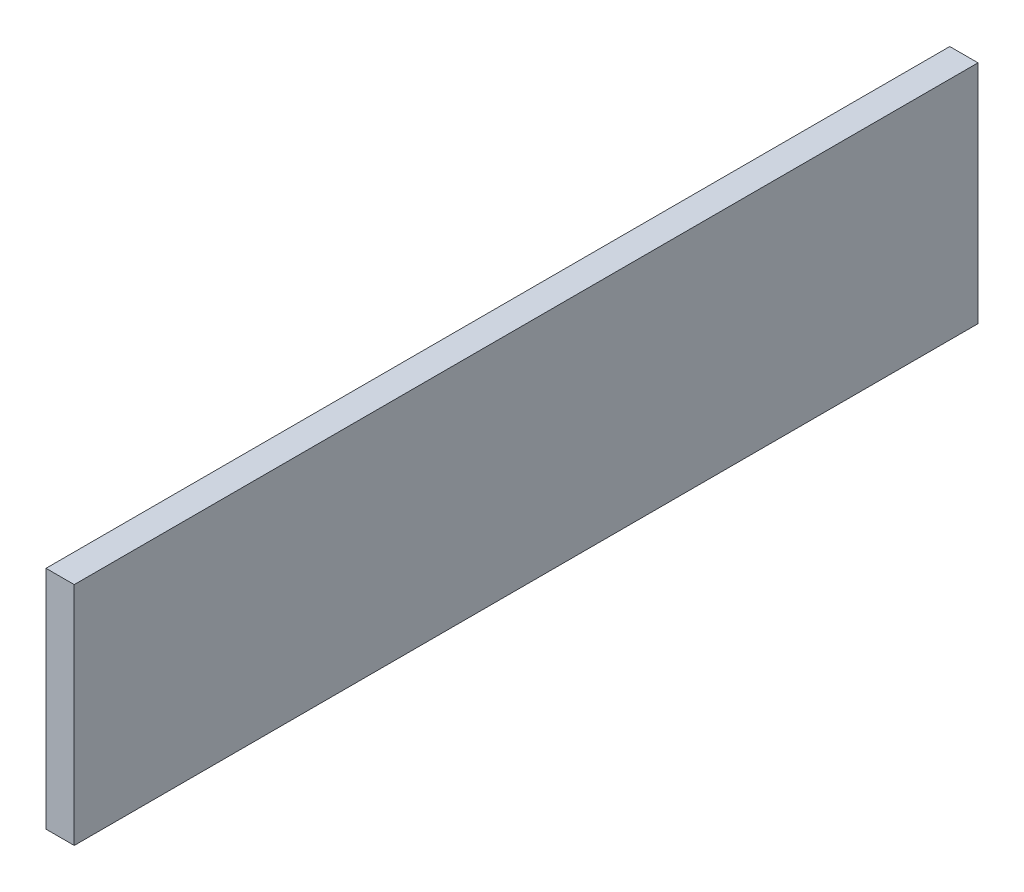
from build123d import *

# Parameters (mm, degrees)
SKETCH1_W           = 6.35
SKETCH1_H           = 50.8
BOSS_EXTRUDE1_DEPTH = 203.2


with BuildPart() as part:
    # Sketch1 → Boss-Extrude1 (new body)
    with BuildSketch(Plane.XY):
        with Locations((3.175, 25.4)):
            Rectangle(SKETCH1_W, SKETCH1_H)
    extrude(amount=BOSS_EXTRUDE1_DEPTH)


solid = part.part
